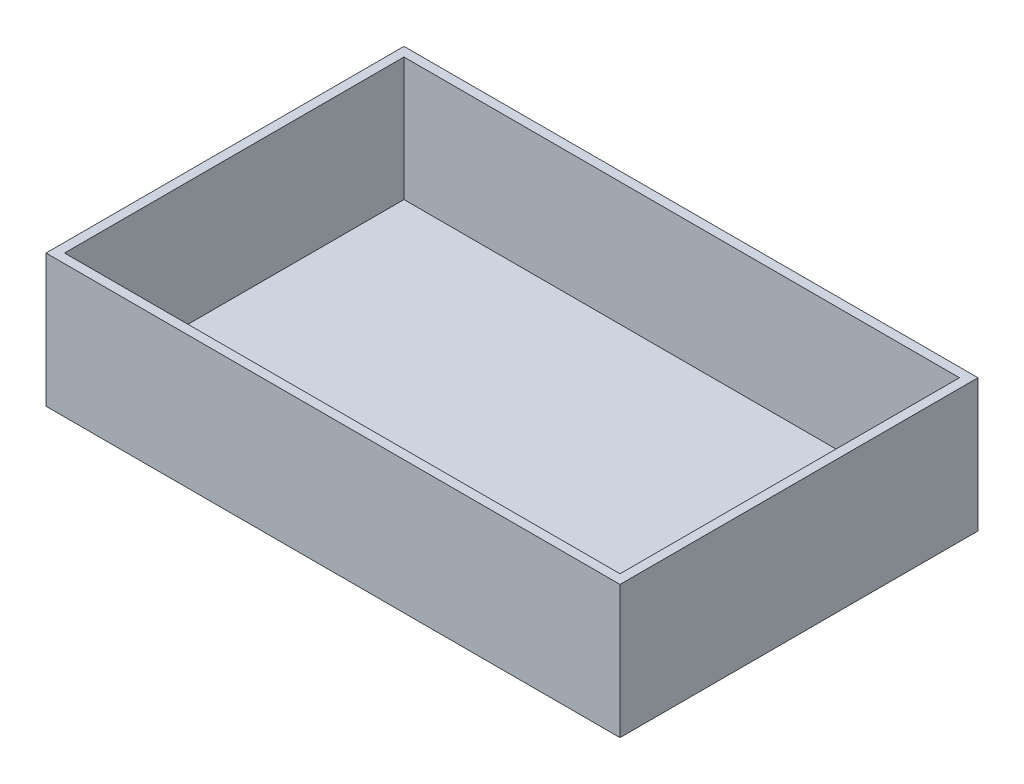
from build123d import *

# Parameters (mm, degrees)
ESBO_O1_W                = 90
ESBO_O1_H                = 55
RESSALTO_EXTRUS_O1_DEPTH = 20
CASCA1_T                 = 1.5


with BuildPart() as part:
    # Esboço1 → Ressalto-extrusão1 (new body)
    with BuildSketch(Plane(origin=(0, 0, 0), x_dir=(1, 0, 0), z_dir=(0, 1, 0))):
        with Locations((-44.890471739, 35.305061179)):
            Rectangle(ESBO_O1_W, ESBO_O1_H)
    extrude(amount=RESSALTO_EXTRUS_O1_DEPTH)

    # Casca1
    casca1_openings = [part.faces().sort_by_distance(p)[0] for p in [
        (-44.890471739, 20, -35.305061179),
    ]]
    offset(amount=CASCA1_T, openings=casca1_openings, kind=Kind.INTERSECTION)


solid = part.part
